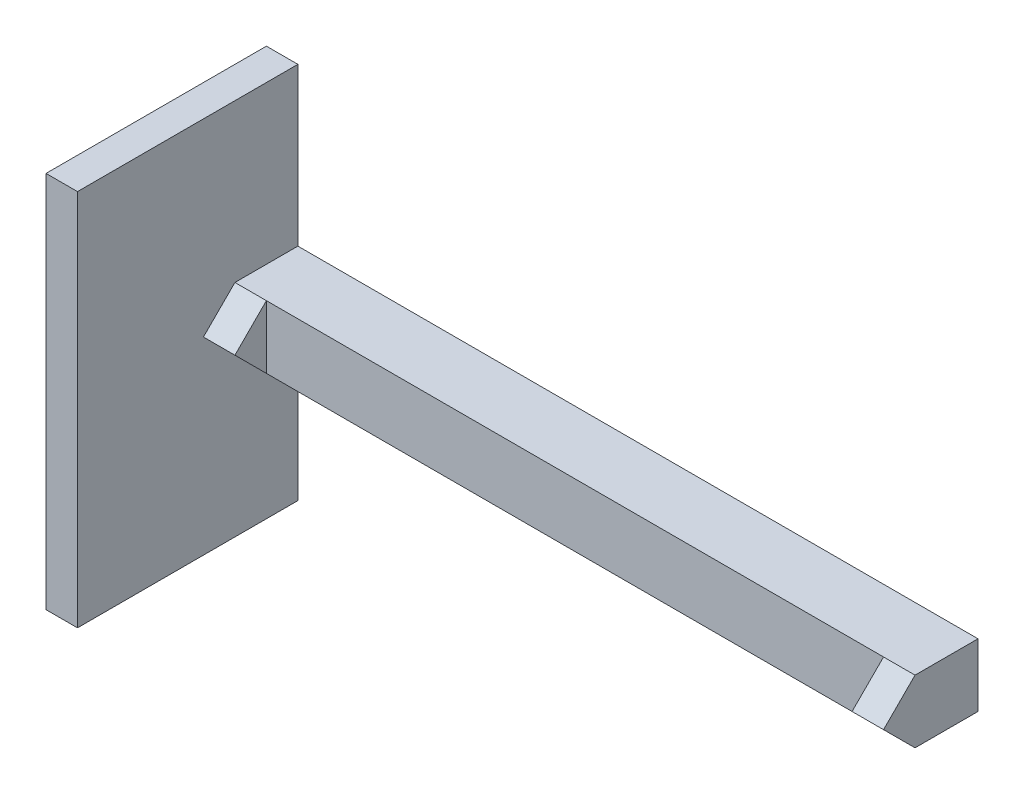
from build123d import *

# Parameters (mm, degrees)
SKETCH1_W           = 10
SKETCH1_H           = 113
BOSS_EXTRUDE1_DEPTH = 10
BOSS_EXTRUDE2_DEPTH = 5
SKETCH4_W           = 60
SKETCH4_H           = 35
BOSS_EXTRUDE3_DEPTH = 5
BOSS_EXTRUDE4_DEPTH = 5


with BuildPart() as part:
    # Sketch1 → Boss-Extrude1 (new body)
    with BuildSketch(Plane(origin=(0, 0, 0), x_dir=(0, 1, 0), z_dir=(0, 0, 1))):
        Rectangle(SKETCH1_W, SKETCH1_H)
    extrude(amount=BOSS_EXTRUDE1_DEPTH)

    # Sketch3 → Boss-Extrude2 (add)
    with BuildSketch(Plane.YZ.offset(56.5)):
        Polygon((-5, 10), (0, 15), (5, 10), align=None)
    extrude(amount=-BOSS_EXTRUDE2_DEPTH)

    # Sketch4 → Boss-Extrude3 (add)
    with BuildSketch(Plane(origin=(-56.5, 0, 0), x_dir=(0, -1, 0), z_dir=(-1, 0, 0))):
        with Locations((0, 17.5)):
            Rectangle(SKETCH4_W, SKETCH4_H)
    extrude(amount=-BOSS_EXTRUDE3_DEPTH)

    # Sketch5 → Boss-Extrude4 (add)
    with BuildSketch(Plane.YZ.offset(-51.5)):
        Polygon((5, 10), (0, 15), (-5, 10), align=None)
    extrude(amount=BOSS_EXTRUDE4_DEPTH)


solid = part.part
